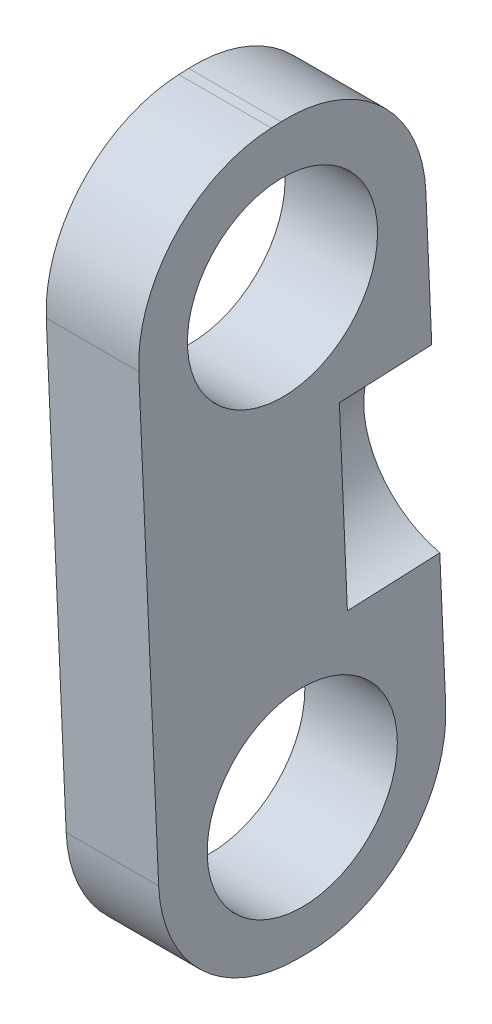
from build123d import *

# Parameters (mm, degrees)
SKETCH1_R           = 3.2639
BOSS_EXTRUDE1_DEPTH = 3.175
FILLET2_R           = 4.7625
SKETCH3_R           = 3.2639
CUT_EXTRUDE1_DEPTH  = 3.175


with BuildPart() as part:
    # Sketch1 → Boss-Extrude1 (new body)
    with BuildSketch(Plane(origin=(0, 0, 0), x_dir=(0, 0, -1), z_dir=(1, 0, 0))):
        Polygon((182.388740953, 7.963264406), (181.834774733, 20.65117682), (171.980710149, 20.220939069), (173.069858002, -4.724648008), (182.942707172, -4.724648008), align=None)
        with Locations((177.123417321, 15.496291061)):
            Circle(SKETCH1_R, mode=Mode.SUBTRACT)
        with Locations((177.8, 0)):
            Circle(SKETCH1_R, mode=Mode.SUBTRACT)
    extrude(amount=BOSS_EXTRUDE1_DEPTH)

    # Fillet2
    fillet2_edges = [part.edges().sort_by_distance(p)[0] for p in [
        (1.5875, -4.724648008, -182.942707172),
        (1.5875, -4.724648008, -173.069858002),
        (1.5875, 20.220939069, -171.980710149),
        (1.5875, 20.65117682, -181.834774733),
    ]]
    fillet(fillet2_edges, radius=FILLET2_R)

    # Sketch3 → Cut-Extrude1 (cut)
    with BuildSketch(Plane(origin=(0, 7.963264406, -182.388740953), x_dir=(-1, 0, 0), z_dir=(0, 0.04361938736533578, -0.9990482215818579))):
        with Locations((-3.96875, 0.106236202)):
            Circle(SKETCH3_R)
    extrude(amount=-CUT_EXTRUDE1_DEPTH, mode=Mode.SUBTRACT)


solid = part.part
